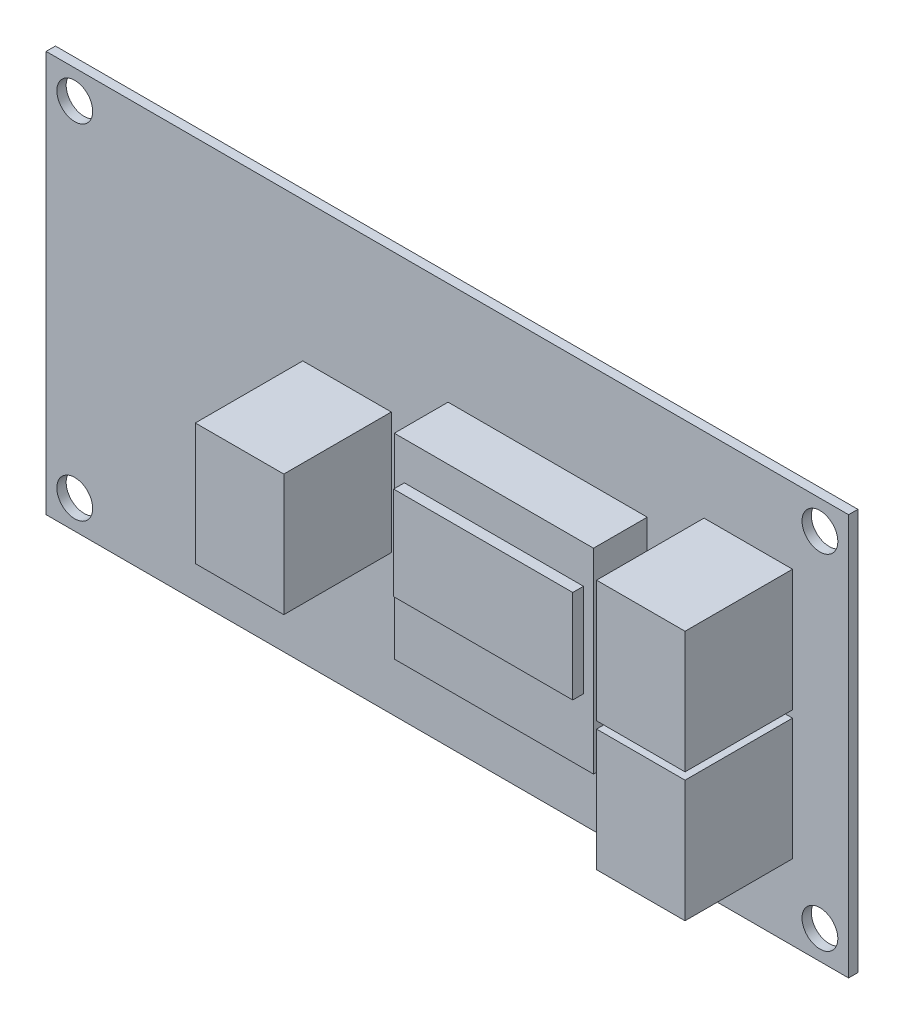
from build123d import *

# Parameters (mm, degrees)
SKETCH1_W           = 56
SKETCH1_H           = 56
BOSS_EXTRUDE1_DEPTH = 1.3
SKETCH2_W           = 6.175
SKETCH2_H           = 17
BOSS_EXTRUDE2_DEPTH = 7.5
SKETCH3_W           = 12.35
SKETCH3_H           = 17
BOSS_EXTRUDE3_DEPTH = 7.5
BOSS_EXTRUDE4_DEPTH = 1.5
SKETCH5_W           = 56
SKETCH5_H           = 56
BOSS_EXTRUDE5_DEPTH = 1.3
SKETCH7_R           = 2.5
CUT_EXTRUDE1_DEPTH  = 1.3
SKETCH8_W           = 6.175
SKETCH8_H           = 8.5
BOSS_EXTRUDE6_DEPTH = 15


with BuildPart() as part:
    # Sketch1 → Boss-Extrude1 (new body)
    with BuildSketch(Plane.XY):
        with Locations((28, 28)):
            Rectangle(SKETCH1_W, SKETCH1_H)
    extrude(amount=BOSS_EXTRUDE1_DEPTH)

    # Sketch2 → Boss-Extrude2 (add)
    with BuildSketch(Plane.XY.offset(1.3)):
        Polygon((14, 28), (14, 41.65), (0.1, 41.65), (0.1, 14.35), (14, 14.35), align=None)
        Polygon((27.9, 41.65), (14, 41.65), (14, 28), (14, 14.35), (27.9, 14.35), align=None)
        with Locations((38.9125, 37)):
            Rectangle(SKETCH2_W, SKETCH2_H)
        with Locations((45.0875, 37)):
            Rectangle(SKETCH2_W, SKETCH2_H)
        with Locations((45.0875, 19)):
            Rectangle(SKETCH2_W, SKETCH2_H)
        with Locations((38.9125, 19)):
            Rectangle(SKETCH2_W, SKETCH2_H)
    extrude(amount=BOSS_EXTRUDE2_DEPTH)

    # Sketch3 → Boss-Extrude3 (add)
    with BuildSketch(Plane.XY.offset(8.8)):
        with Locations((42, 37)):
            Rectangle(SKETCH3_W, SKETCH3_H)
        with Locations((42, 19)):
            Rectangle(SKETCH3_W, SKETCH3_H)
    extrude(amount=BOSS_EXTRUDE3_DEPTH)

    # Sketch4 → Boss-Extrude4 (add)
    with BuildSketch(Plane.XY.offset(8.8)):
        Polygon((26.5, 23.35), (14, 23.35), (1.5, 23.35), (1.5, 36.35), (26.5, 36.35), align=None)
    extrude(amount=BOSS_EXTRUDE4_DEPTH)

    # Sketch5 → Boss-Extrude5 (add)
    with BuildSketch(Plane.XY.offset(1.3)):
        with Locations((-28, 28)):
            Rectangle(SKETCH5_W, SKETCH5_H)
    extrude(amount=-BOSS_EXTRUDE5_DEPTH)

    # Sketch7 → Cut-Extrude1 (cut)
    with BuildSketch(Plane.XY.offset(1.3)):
        with Locations((-52, 52)):
            Circle(SKETCH7_R)
        with Locations((-52, 4)):
            Circle(SKETCH7_R)
        with Locations((52, 4)):
            Circle(SKETCH7_R)
        with Locations((52, 52)):
            Circle(SKETCH7_R)
    extrude(amount=-CUT_EXTRUDE1_DEPTH, mode=Mode.SUBTRACT)

    # Sketch8 → Boss-Extrude6 (add)
    with BuildSketch(Plane.XY.offset(1.3)):
        Polygon((-7.825, 36.5), (-14, 36.5), (-14, 28), (-14, 19.5), (-7.825, 19.5), align=None)
        with Locations((-17.0875, 32.25)):
            Rectangle(SKETCH8_W, SKETCH8_H)
        with Locations((-17.0875, 23.75)):
            Rectangle(SKETCH8_W, SKETCH8_H)
    extrude(amount=BOSS_EXTRUDE6_DEPTH)


solid = part.part
